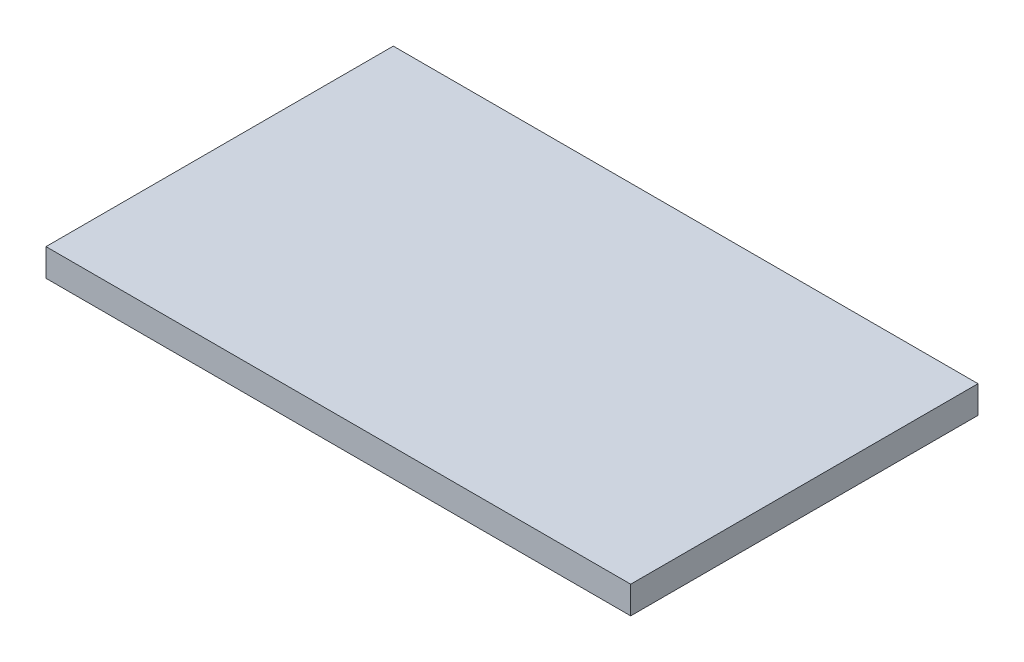
from build123d import *

# Parameters (mm, degrees)
SKETCH1_W            = 1277
SKETCH1_H            = 60
STORE_PU_ALT_1_DEPTH = 758.5


with BuildPart() as part:
    # Sketch1 → STORE_pu_alt_1 (new body)
    with BuildSketch(Plane.XY):
        with Locations((700, 151.5)):
            Rectangle(SKETCH1_W, SKETCH1_H)
    extrude(amount=-STORE_PU_ALT_1_DEPTH)


solid = part.part
